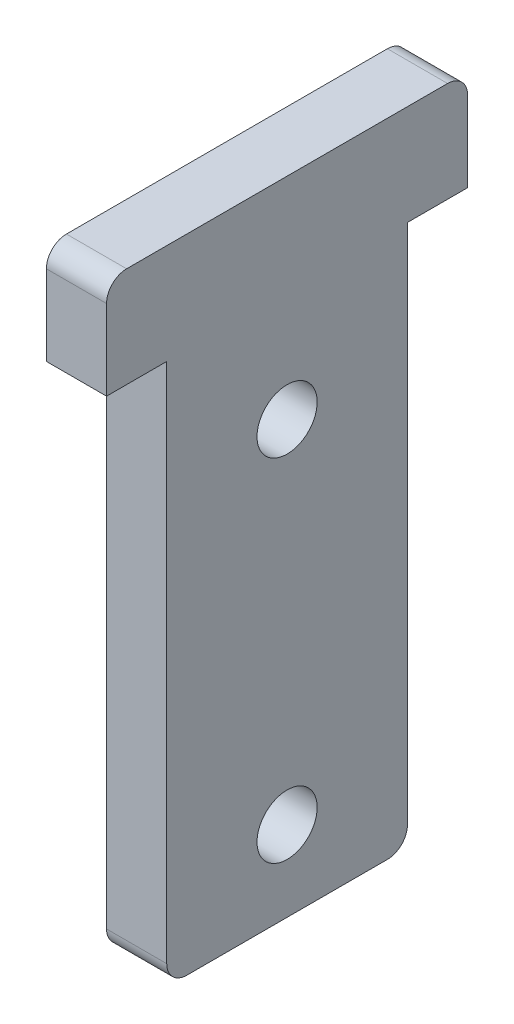
from build123d import *

# Parameters (mm, degrees)
SKETCH1_W           = 18
SKETCH1_H           = 32
BOSS_EXTRUDE1_DEPTH = 3
SKETCH2_R           = 1.5
CUT_EXTRUDE2_DEPTH  = 3


with BuildPart() as part:
    # Sketch1 → Boss-Extrude1 (new body)
    with BuildSketch(Plane(origin=(0, 0, 0), x_dir=(0, 0, -1), z_dir=(1, 0, 0))):
        Rectangle(SKETCH1_W, SKETCH1_H)
    extrude(amount=BOSS_EXTRUDE1_DEPTH)

    # Sketch2 → Cut-Extrude2 (cut)
    with BuildSketch(Plane(origin=(3, 0, 0), x_dir=(0, 0, -1), z_dir=(1, 0, 0))):
        with BuildLine():
            ThreePointArc((8, 16), (8.707106781, 15.707106781), (9, 15))
            Line((9, 15), (9, 16))
            Line((9, 16), (8, 16))
        make_face()
        with BuildLine():
            ThreePointArc((-9, 15), (-8.707106781, 15.707106781), (-8, 16))
            Line((-8, 16), (-9, 16))
            Line((-9, 16), (-9, 15))
        make_face()
        with BuildLine():
            Line((-6, -16), (-5, -16))
            ThreePointArc((-5, -16), (-5.707106781, -15.707106781), (-6, -15))
            Line((-6, -15), (-6, 11))
            Line((-6, 11), (-9, 11))
            Line((-9, 11), (-9, -16))
            Line((-9, -16), (-6, -16))
        make_face()
        with BuildLine():
            Line((6, 11), (6, -15))
            ThreePointArc((6, -15), (5.707106781, -15.707106781), (5, -16))
            Line((5, -16), (6, -16))
            Line((6, -16), (9, -16))
            Line((9, -16), (9, 11))
            Line((9, 11), (6, 11))
        make_face()
        with Locations((0, 5.5)):
            Circle(SKETCH2_R)
        with Locations((0, -12)):
            Circle(SKETCH2_R)
    extrude(amount=-CUT_EXTRUDE2_DEPTH, mode=Mode.SUBTRACT)


solid = part.part
